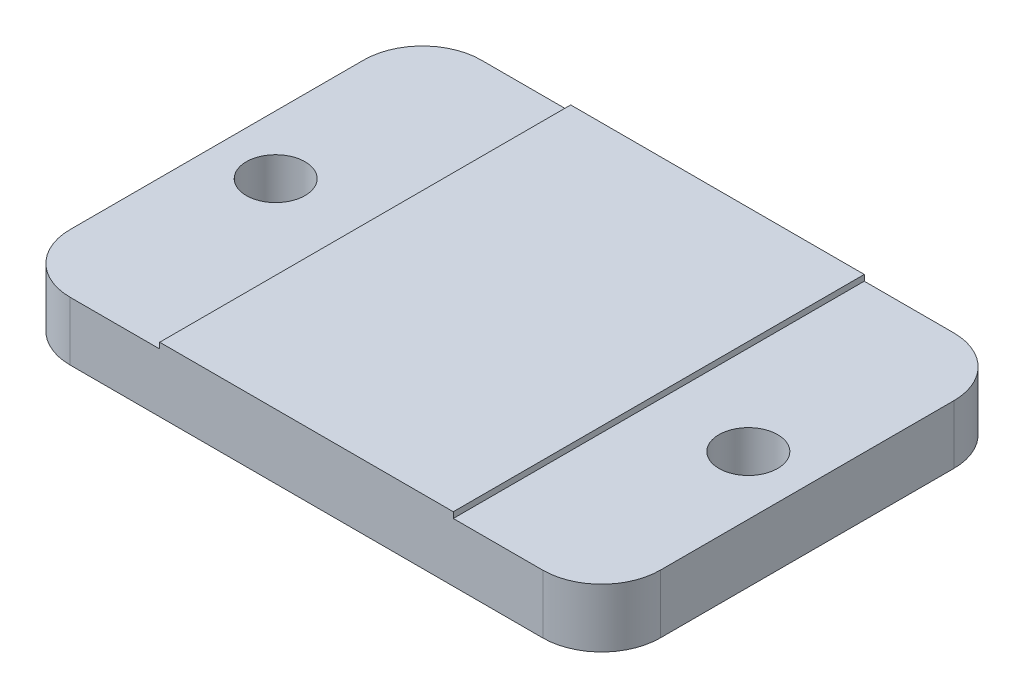
from build123d import *

# Parameters (mm, degrees)
SKETCH_1_W      = 20.1
SKETCH_1_H      = 14
SKETCH_1_R      = 1
EXTRUDE_1_DEPTH = 2
SKETCH_2_W      = 10
SKETCH_2_H      = 14
EXTRUDE_2_DEPTH = 0.2
FILLET_1_R      = 2


with BuildPart() as part:
    # 草图1 → 凸台-拉伸1 (new body)
    with BuildSketch(Plane(origin=(0, 0, 0), x_dir=(1, 0, 0), z_dir=(0, 1, 0))):
        Rectangle(SKETCH_1_W, SKETCH_1_H)
        with Locations(Location((-8.05, 0, 0), (0, 0, 270))):
            Circle(SKETCH_1_R, mode=Mode.SUBTRACT)
        with Locations(Location((8.05, 0, 0), (0, 0, 90))):
            Circle(SKETCH_1_R, mode=Mode.SUBTRACT)
    extrude(amount=EXTRUDE_1_DEPTH)

    # 草图2 → 凸台-拉伸2 (add)
    with BuildSketch(Plane(origin=(0, 2, 0), x_dir=(1, 0, 0), z_dir=(0, 1, 0))):
        Rectangle(SKETCH_2_W, SKETCH_2_H)
    extrude(amount=EXTRUDE_2_DEPTH)

    # 圆角1
    fillet_1_edges = [part.edges().sort_by_distance(p)[0] for p in [
        (10.05, 1, 7),
        (-10.05, 1, 7),
        (-10.05, 1, -7),
        (10.05, 1, -7),
    ]]
    fillet(fillet_1_edges, radius=FILLET_1_R)


solid = part.part
